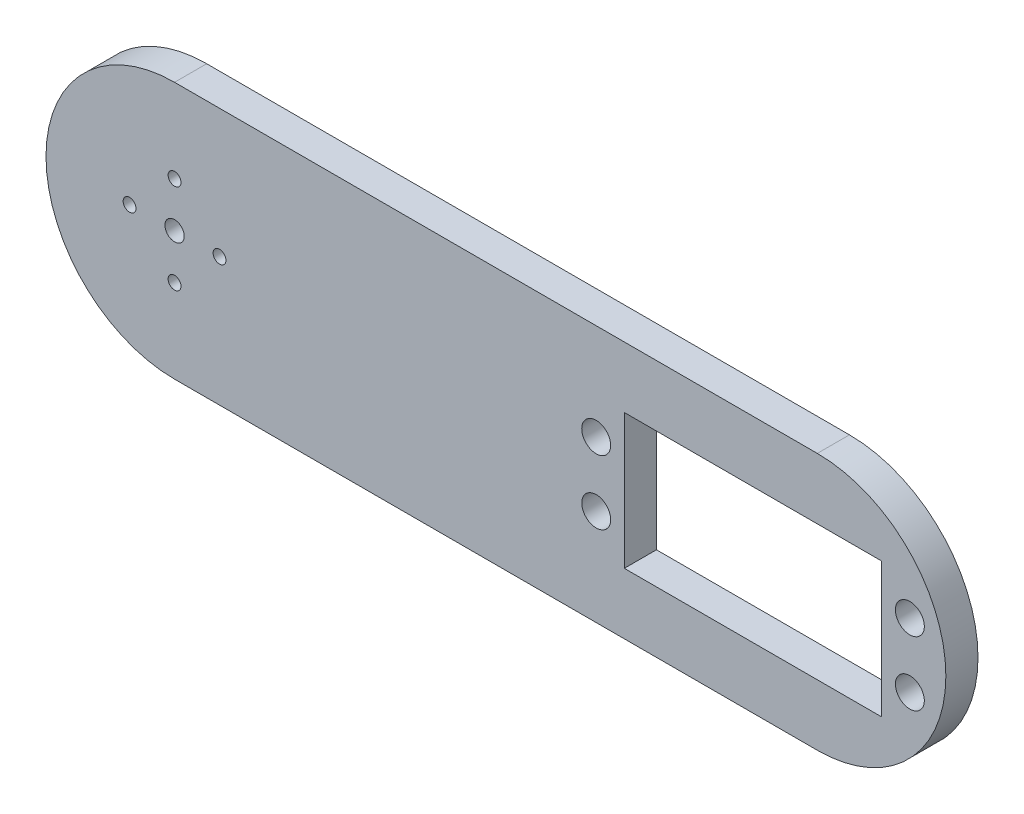
from build123d import *

# Parameters (mm, degrees)
BOSS_EXTRUDE1_DEPTH   = 5
CUT_EXTRUDE1_REACH    = 123.758
SKETCH2_R             = 1.5
SKETCH2_R_2           = 1
BODY_MOVE_COPY1_ANGLE = 90
SKETCH19_R            = 2.25
SKETCH19_W            = 40.05
SKETCH19_H            = 21
CUT_EXTRUDE9_DEPTH    = 122.757956619


with BuildPart() as part:
    # Sketch1 → Boss-Extrude1 (new body)
    with BuildSketch(Plane(origin=(0, 0, 0), x_dir=(1, 0, 0), z_dir=(0, 1, 0))):
        with BuildLine():
            Line((100, -20), (0, -20))
            ThreePointArc((0, -20), (-20, 0), (0, 20))
            Line((0, 20), (100, 20))
            ThreePointArc((100, 20), (120, 0), (100, -20))
        make_face()
    extrude(amount=BOSS_EXTRUDE1_DEPTH)

    # Sketch2 → Cut-Extrude1 (cut, up to next)
    with BuildSketch(Plane(origin=(0, 5, 0), x_dir=(1, 0, 0), z_dir=(0, 1, 0)), mode=Mode.PRIVATE) as cut_extrude1_sk1:
        with Locations(Location((0, 0, 0), (0, 0, 270))):
            Circle(SKETCH2_R)
    cut_extrude1_tool1 = extrude(cut_extrude1_sk1.sketch, amount=-CUT_EXTRUDE1_REACH, mode=Mode.PRIVATE) & part.part
    # Sketch2 → Cut-Extrude1 (cut, up to next)
    with BuildSketch(Plane(origin=(0, 5, 0), x_dir=(1, 0, 0), z_dir=(0, 1, 0)), mode=Mode.PRIVATE) as cut_extrude1_sk2:
        with Locations(Location((0, 7, 0), (0, 0, 270))):
            Circle(SKETCH2_R_2)
    cut_extrude1_tool2 = extrude(cut_extrude1_sk2.sketch, amount=-CUT_EXTRUDE1_REACH, mode=Mode.PRIVATE) & part.part
    # Sketch2 → Cut-Extrude1 (cut, up to next)
    with BuildSketch(Plane(origin=(0, 5, 0), x_dir=(1, 0, 0), z_dir=(0, 1, 0)), mode=Mode.PRIVATE) as cut_extrude1_sk3:
        with Locations(Location((7.001, 0.001, 0), (0, 0, 270))):
            Circle(SKETCH2_R_2)
    cut_extrude1_tool3 = extrude(cut_extrude1_sk3.sketch, amount=-CUT_EXTRUDE1_REACH, mode=Mode.PRIVATE) & part.part
    # Sketch2 → Cut-Extrude1 (cut, up to next)
    with BuildSketch(Plane(origin=(0, 5, 0), x_dir=(1, 0, 0), z_dir=(0, 1, 0)), mode=Mode.PRIVATE) as cut_extrude1_sk4:
        with Locations(Location((0.002, -7, 0), (0, 0, 270))):
            Circle(SKETCH2_R_2)
    cut_extrude1_tool4 = extrude(cut_extrude1_sk4.sketch, amount=-CUT_EXTRUDE1_REACH, mode=Mode.PRIVATE) & part.part
    # Sketch2 → Cut-Extrude1 (cut, up to next)
    with BuildSketch(Plane(origin=(0, 5, 0), x_dir=(1, 0, 0), z_dir=(0, 1, 0)), mode=Mode.PRIVATE) as cut_extrude1_sk5:
        with Locations(Location((-6.999, -0.001, 0), (0, 0, 270))):
            Circle(SKETCH2_R_2)
    cut_extrude1_tool5 = extrude(cut_extrude1_sk5.sketch, amount=-CUT_EXTRUDE1_REACH, mode=Mode.PRIVATE) & part.part
    add(cut_extrude1_tool1.solids().sort_by_distance((0, 5, 0))[0], mode=Mode.SUBTRACT)
    add(cut_extrude1_tool2.solids().sort_by_distance((0, 5, -7))[0], mode=Mode.SUBTRACT)
    add(cut_extrude1_tool3.solids().sort_by_distance((7.001, 5, -0.001))[0], mode=Mode.SUBTRACT)
    add(cut_extrude1_tool4.solids().sort_by_distance((0.002, 5, 7))[0], mode=Mode.SUBTRACT)
    add(cut_extrude1_tool5.solids().sort_by_distance((-6.999, 5, 0.001))[0], mode=Mode.SUBTRACT)


with BuildPart() as part_1:
    # Body-Move/Copy1: moved
    add(part.part.rotate(Axis((0, 0, 0), (1, 0, 0)), BODY_MOVE_COPY1_ANGLE))

    # Sketch19 → Cut-Extrude9 (cut, through all)
    with BuildSketch(Plane.XY.offset(5)):
        with Locations((114.4, -5)):
            Circle(SKETCH19_R)
        with Locations(Location((114.4, 5, 0), (0, 0, 180))):
            Circle(SKETCH19_R)
        with Locations(Location((65.6, 5, 0), (0, 0, 180))):
            Circle(SKETCH19_R)
        with Locations((65.6, -5)):
            Circle(SKETCH19_R)
        with Locations((90, 0)):
            Rectangle(SKETCH19_W, SKETCH19_H)
    extrude(amount=-CUT_EXTRUDE9_DEPTH, mode=Mode.SUBTRACT)


with BuildPart() as part_2:
    # Body-Move/Copy2: moved
    add(part_1.part.moved(Location((0, 0, -5))))


solid = part_2.part
